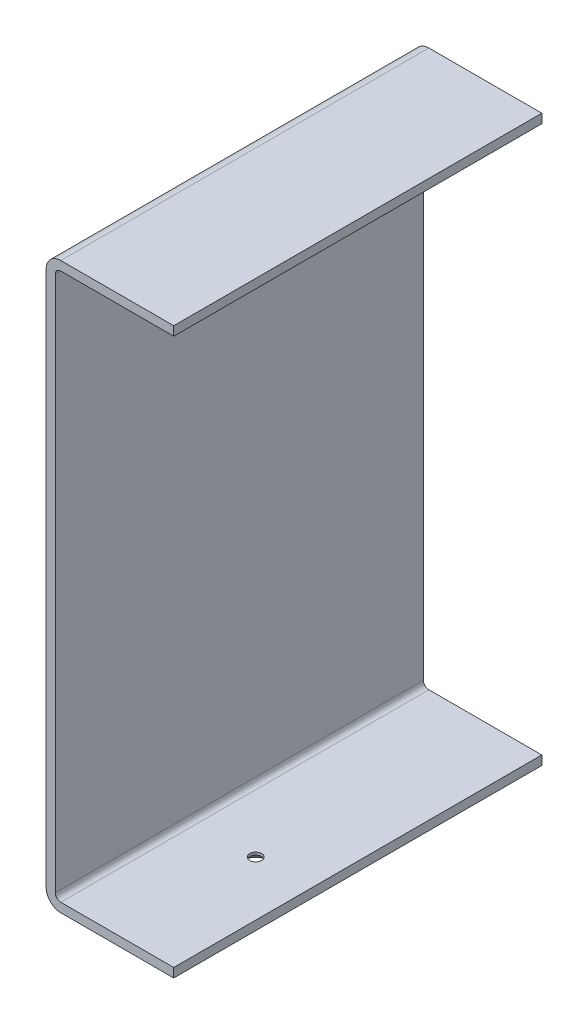
from build123d import *

# Parameters (mm, degrees)
EXTRUDE_1_DEPTH             = 202
HOLE_WIZARD_M61_D           = 6.6
HOLE_WIZARD_M61_DEPTH       = 10
HOLE_WIZARD_M61_CSINK_D     = 13.71
HOLE_WIZARD_M61_CSINK_ANGLE = 90
HOLE_WIZARD_M61_TIP         = 1.982840043


with BuildPart() as part:
    # Эскиз1 → Бобышка-Вытянуть1 (new body)
    with BuildSketch(Plane.XY):
        with BuildLine():
            Line((70, 0), (8, 0))
            ThreePointArc((8, 0), (2.343145751, 2.343145751), (0, 8))
            Line((0, 8), (0, 302))
            ThreePointArc((0, 302), (2.343145751, 307.656854249), (8, 310))
            Line((8, 310), (70, 310))
            Line((70, 310), (70, 305))
            Line((70, 305), (8, 305))
            ThreePointArc((8, 305), (5.878679656, 304.121320344), (5, 302))
            Line((5, 302), (5, 8))
            ThreePointArc((5, 8), (5.878679656, 5.878679656), (8, 5))
            Line((8, 5), (70, 5))
            Line((70, 5), (70, 0))
        make_face()
    extrude(amount=EXTRUDE_1_DEPTH)

    # Зенковка для винта с потайной головкой и внутренним шестигранником M61
    with Locations(Plane.XZ):
        with Locations((40, 127)):
            CounterSinkHole(HOLE_WIZARD_M61_D / 2, HOLE_WIZARD_M61_CSINK_D / 2, depth=HOLE_WIZARD_M61_DEPTH, counter_sink_angle=HOLE_WIZARD_M61_CSINK_ANGLE)
            with Locations((0, 0, -(HOLE_WIZARD_M61_DEPTH + HOLE_WIZARD_M61_TIP / 2))):  # 118° drill point
                Cone(0, HOLE_WIZARD_M61_D / 2, HOLE_WIZARD_M61_TIP, mode=Mode.SUBTRACT)


solid = part.part
